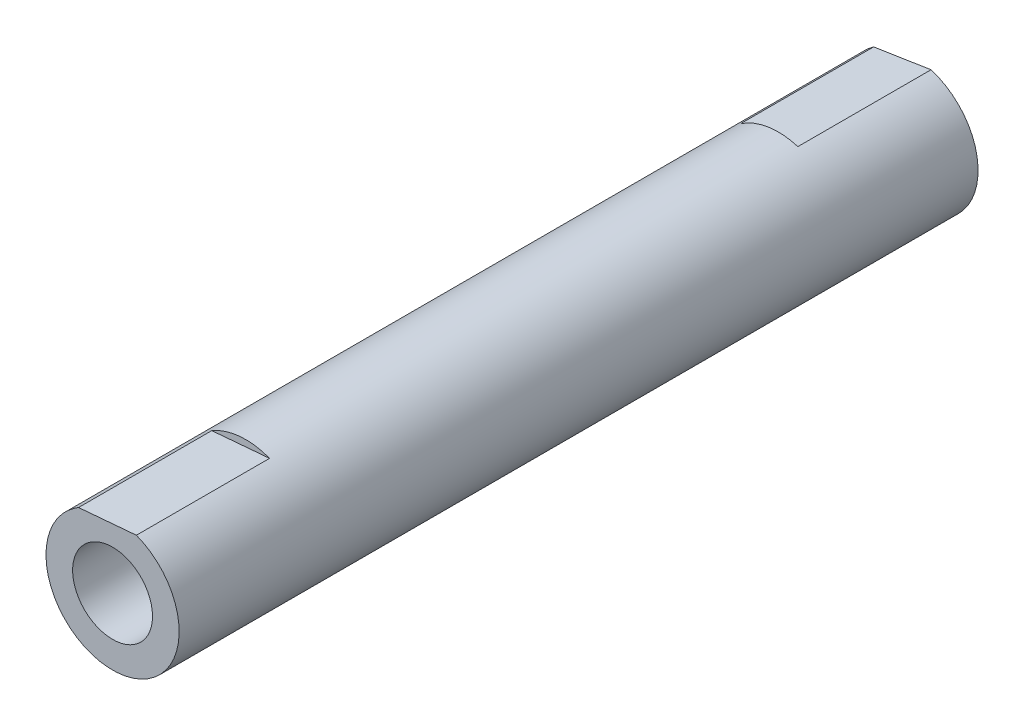
from build123d import *

# Parameters (mm, degrees)
SKETCH1_R           = 5
SKETCH1_R_2         = 3
BOSS_EXTRUDE1_DEPTH = 30
CUT_EXTRUDE1_DEPTH  = 10
CUT_EXTRUDE2_START  = -10
CUT_EXTRUDE2_DEPTH  = 10


with BuildPart() as part:
    # Sketch1 → Boss-Extrude1 (new, symmetric)
    with BuildSketch(Plane.XY):
        Circle(SKETCH1_R)
        Circle(SKETCH1_R_2, mode=Mode.SUBTRACT)
    extrude(amount=BOSS_EXTRUDE1_DEPTH, both=True)

    # Sketch2 → Cut-Extrude1 (cut)
    with BuildSketch(Plane.XY.offset(30)):
        with BuildLine():
            Line((-2.552883618, 4.299160992), (1.790341652, 4.668476922))
            ThreePointArc((1.790341652, 4.668476922), (-0.423634426, 4.982021063), (-2.552883618, 4.299160992))
        make_face()
    extrude(amount=-CUT_EXTRUDE1_DEPTH, mode=Mode.SUBTRACT)

    # Sketch3 → Cut-Extrude2 (cut)
    with BuildSketch(Plane(origin=(0, 0, -30), x_dir=(-1, 0, 0), z_dir=(0, 0, -1)).offset(CUT_EXTRUDE2_START)):
        with BuildLine():
            Line((-1.466184621, 4.780199019), (2.841518337, 4.114094498))
            ThreePointArc((2.841518337, 4.114094498), (0.764074287, 4.941274176), (-1.466184621, 4.780199019))
        make_face()
    extrude(amount=CUT_EXTRUDE2_DEPTH, mode=Mode.SUBTRACT)


solid = part.part
